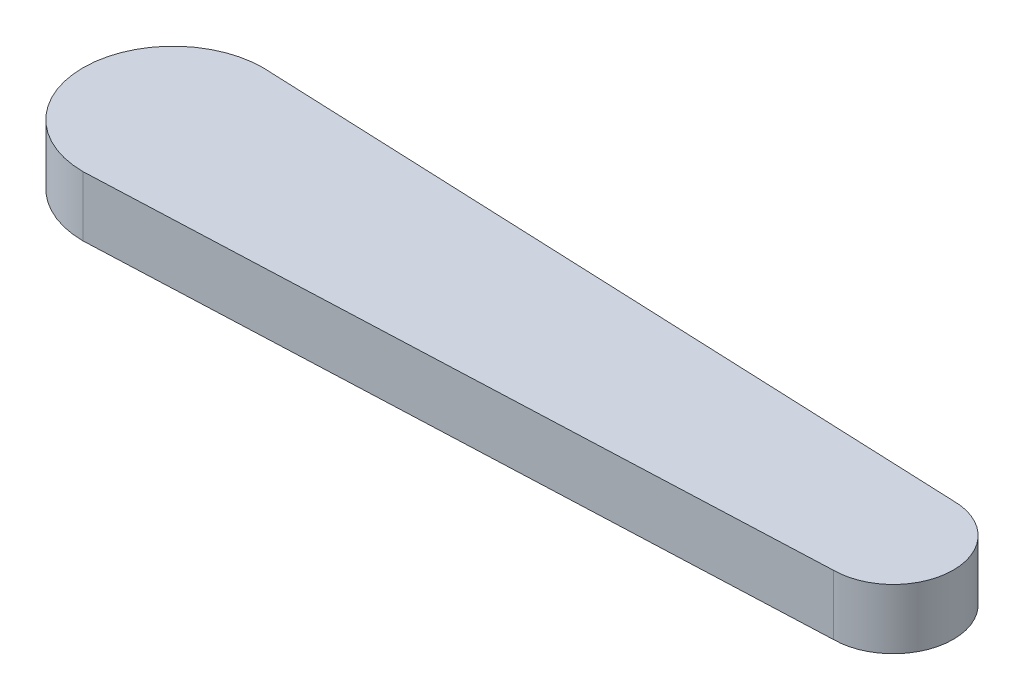
from build123d import *

# Parameters (mm, degrees)
BOSS_EXTRUDE1_DEPTH = 10


with BuildPart() as part:
    # Sketch1 → Boss-Extrude1 (new body)
    with BuildSketch(Plane(origin=(0, 0, 0), x_dir=(1, 0, 0), z_dir=(0, 1, 0))):
        with BuildLine():
            Line((58.533362025, 10), (-60.218804352, 14.948006932))
            ThreePointArc((-60.218804352, 14.948006932), (-50.427672798, 10.155847962), (-46.466637975, 0))
            ThreePointArc((-46.466637975, 0), (-50.427672798, -10.155847962), (-60.218804352, -14.948006932))
            Line((-60.218804352, -14.948006932), (58.533362025, -10))
            ThreePointArc((58.533362025, -10), (48.533362025, 0), (58.533362025, 10))
        make_face()
        with BuildLine():
            Line((-61.466637975, -15), (-61.466637975, 15))
            ThreePointArc((-61.466637975, 15), (-76.466637975, 0), (-61.466637975, -15))
        make_face()
        with BuildLine():
            ThreePointArc((68.533362025, 0), (65.604429837, 7.071067812), (58.533362025, 10))
            Line((58.533362025, 10), (58.533362025, -10))
            ThreePointArc((58.533362025, -10), (65.604429837, -7.071067812), (68.533362025, 0))
        make_face()
        with BuildLine():
            Line((58.533362025, -10), (58.533362025, 10))
            ThreePointArc((58.533362025, 10), (48.533362025, 0), (58.533362025, -10))
        make_face()
        with BuildLine():
            Line((-60.218804352, 14.948006932), (-61.466637975, 15))
            Line((-61.466637975, 15), (-61.466637975, -15))
            Line((-61.466637975, -15), (-60.218804352, -14.948006932))
            ThreePointArc((-60.218804352, -14.948006932), (-50.427672798, -10.155847962), (-46.466637975, 0))
            ThreePointArc((-46.466637975, 0), (-50.427672798, 10.155847962), (-60.218804352, 14.948006932))
        make_face()
    extrude(amount=BOSS_EXTRUDE1_DEPTH)


solid = part.part
